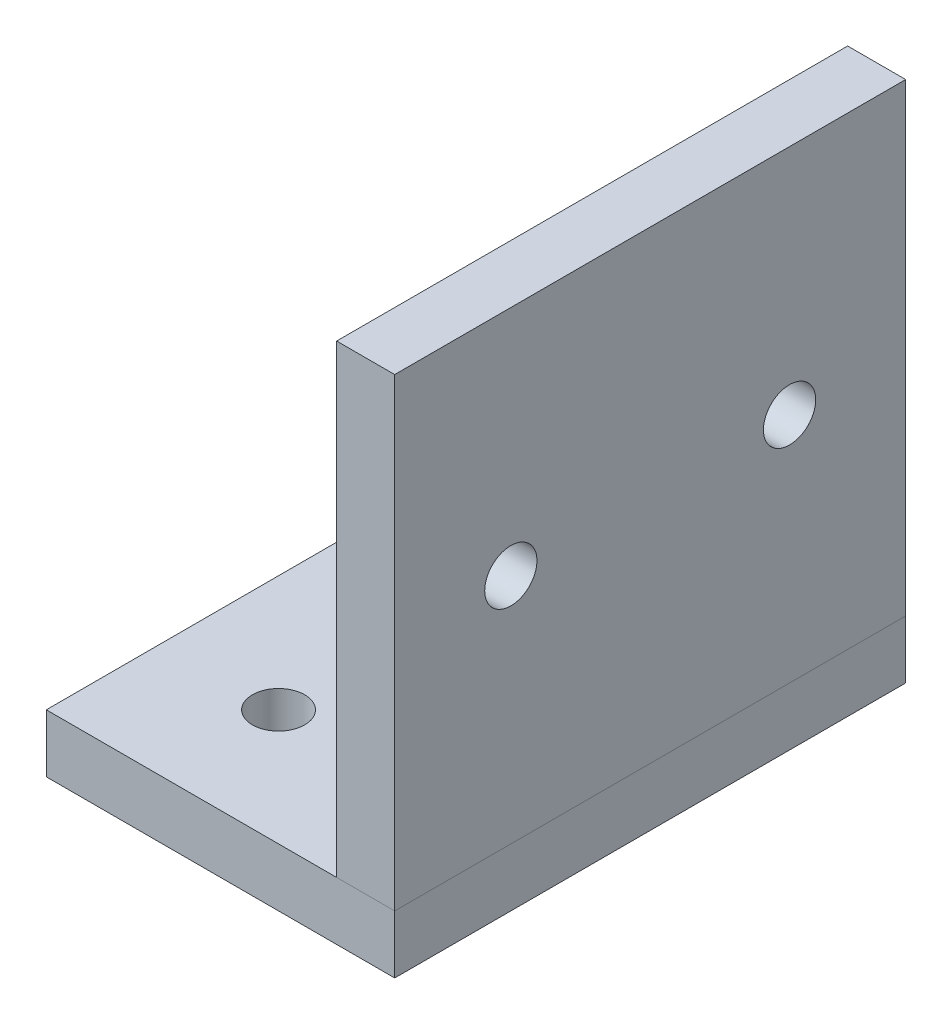
from build123d import *

# Parameters (mm, degrees)
SKETCH1_W           = 30
SKETCH1_H           = 44
BOSS_EXTRUDE1_DEPTH = 5
SKETCH2_R           = 2.25
CUT_EXTRUDE1_DEPTH  = 28.092434368
SKETCH4_W           = 5
SKETCH4_H           = 44
BOSS_EXTRUDE3_DEPTH = 40
SKETCH5_R           = 2.25
CUT_EXTRUDE3_DEPTH  = 56.982140009


with BuildPart() as part:
    # Sketch1 → Boss-Extrude1 (new body)
    with BuildSketch(Plane(origin=(0, 0, 0), x_dir=(1, 0, 0), z_dir=(0, 1, 0))):
        Rectangle(SKETCH1_W, SKETCH1_H)
    extrude(amount=BOSS_EXTRUDE1_DEPTH)

    # Sketch2 → Cut-Extrude1 (cut, through all)
    with BuildSketch(Plane(origin=(0, 5, 0), x_dir=(1, 0, 0), z_dir=(0, 1, 0))):
        with Locations(Location((-5, -12, 0), (0, 0, 270))):
            Circle(SKETCH2_R)
        with Locations(Location((-5, 12, 0), (0, 0, 270))):
            Circle(SKETCH2_R)
    extrude(amount=-CUT_EXTRUDE1_DEPTH, mode=Mode.SUBTRACT)


with BuildPart() as body_2:
    # Sketch4 → Boss-Extrude3 (new body)
    with BuildSketch(Plane(origin=(0, 5, 0), x_dir=(1, 0, 0), z_dir=(0, 1, 0))):
        with Locations((12.5, 0)):
            Rectangle(SKETCH4_W, SKETCH4_H)
    extrude(amount=BOSS_EXTRUDE3_DEPTH)

    # Sketch5 → Cut-Extrude3 (cut, through all)
    with BuildSketch(Plane.ZY.offset(-10)):
        with Locations((12, 25)):
            Circle(SKETCH5_R)
        with Locations((-12, 25)):
            Circle(SKETCH5_R)
    extrude(amount=-CUT_EXTRUDE3_DEPTH, mode=Mode.SUBTRACT)


solid = Compound([part.part, body_2.part])
